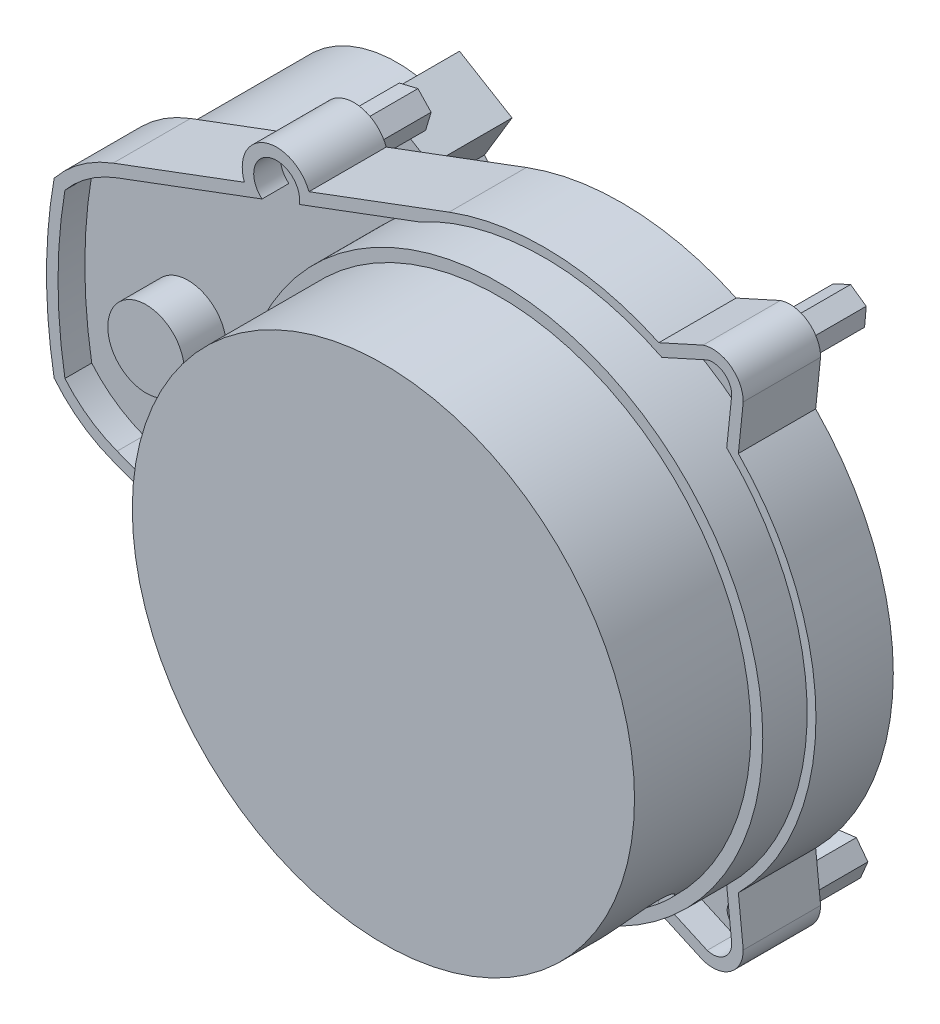
from build123d import *

# Parameters (mm, degrees)
ESQUISSE1_R             = 1.6
BOSS_EXTRU_1_DEPTH      = 10.1
ESQUISSE2_R             = 32.8
BOSS_EXTRU_2_DEPTH      = 21
ENL_V_MAT_EXTRU_1_DEPTH = 3.5
ESQUISSE4_R             = 32.8
BOSS_EXTRU_3_DEPTH      = 3.5
ESQUISSE5_R             = 16
BOSS_EXTRU_4_DEPTH      = 20.7
ESQUISSE8_R             = 5
BOSS_EXTRU_7_DEPTH      = 5.5
SKETCH6_R               = 34.35
BOSS_EXTRUDE3_DEPTH     = 9.3
CUT_EXTRUDE1_REACH      = 83.139
CUT_EXTRUDE1_END_RADIUS = 32.8
SKETCH5_R               = 5.25
ESQUISSE6_R             = 1
BOSS_EXTRU_5_DEPTH      = 7.7
BOSS_EXTRUDE4_DEPTH     = 10.6


with BuildPart() as part:
    # Esquisse1 → Boss.-Extru.1 (new body)
    with BuildSketch(Plane.XY):
        with BuildLine():
            ThreePointArc((-56.3, -16.861494596), (-60.528670487, -14.599558136), (-64.01, -11.301322931))
            ThreePointArc((-64.01, -11.301322931), (-65, 0), (-64.01, 11.301322931))
            ThreePointArc((-64.01, 11.301322931), (-60.528670487, 14.599558136), (-56.3, 16.861494596))
            Line((-56.3, 16.861494596), (-39.156313776, 23.266930519))
            ThreePointArc((-39.156313776, 23.266930519), (-36.515940127, 29.057304168), (-30.725566478, 26.416930519))
            Line((-30.725566478, 26.416930519), (-12.425, 33.254614341))
            ThreePointArc((-12.425, 33.254614341), (1.381675102, 35.473102119), (14.973963383, 32.187426436))
            Line((14.973963383, 32.187426436), (20.756023105, 34.801647207))
            ThreePointArc((20.756023105, 34.801647207), (24.347774736, 34.238511045), (26, 31))
            Line((26, 31), (25.359978077, 24.841930519))
            ThreePointArc((25.359978077, 24.841930519), (35.5, 0), (25.359978077, -24.841930519))
            Line((25.359978077, -24.841930519), (26, -31))
            ThreePointArc((26, -31), (24.347774736, -34.238511045), (20.756023105, -34.801647207))
            Line((20.756023105, -34.801647207), (14.973963383, -32.187426436))
            ThreePointArc((14.973963383, -32.187426436), (1.381675102, -35.473102119), (-12.425, -33.254614341))
            Line((-12.425, -33.254614341), (-30.725566478, -26.416930519))
            ThreePointArc((-30.725566478, -26.416930519), (-36.515940127, -29.057304168), (-39.156313776, -23.266930519))
            Line((-39.156313776, -23.266930519), (-56.3, -16.861494596))
        make_face()
        with Locations((-35, -25)):
            Circle(ESQUISSE1_R, mode=Mode.SUBTRACT)
        with Locations((22, 31)):
            Circle(ESQUISSE1_R, mode=Mode.SUBTRACT)
        with Locations((-35, 25)):
            Circle(ESQUISSE1_R, mode=Mode.SUBTRACT)
        with Locations((22, -31)):
            Circle(ESQUISSE1_R, mode=Mode.SUBTRACT)
    extrude(amount=BOSS_EXTRU_1_DEPTH)

    # Esquisse2 → Boss.-Extru.2 (add)
    with BuildSketch(Plane.XY.offset(10.1)):
        with Locations(Location((0, 0, 0), (0, 0, 180))):
            Circle(ESQUISSE2_R)
    extrude(amount=BOSS_EXTRU_2_DEPTH)

    # Esquisse3 → Enlèv. mat.-Extru.1 (cut)
    with BuildSketch(Plane.XY.offset(10.1)):
        with BuildLine():
            Line((-55.775, -15.456370046), (-36.849687238, -22.527479296))
            ThreePointArc((-36.849687238, -22.527479296), (-35.990940127, -27.652179619), (-31.982193016, -24.346132644))
            Line((-31.982193016, -24.346132644), (-11.9, -31.849489792))
            ThreePointArc((-11.9, -31.849489792), (1.664031028, -33.959255009), (14.956816294, -30.533484019))
            Line((14.956816294, -30.533484019), (21.291141631, -33.397398551))
            ThreePointArc((21.291141631, -33.397398551), (23.468656713, -33.023128137), (24.499056843, -31.06866508))
            Line((24.499056843, -31.06866508), (23.79417774, -24.286562245))
            ThreePointArc((23.79417774, -24.286562245), (34, 0), (23.79417774, 24.286562245))
            Line((23.79417774, 24.286562245), (24.499056843, 31.06866508))
            ThreePointArc((24.499056843, 31.06866508), (23.468656713, 33.023128137), (21.291141631, 33.397398551))
            Line((21.291141631, 33.397398551), (14.956816294, 30.533484019))
            ThreePointArc((14.956816294, 30.533484019), (1.664031028, 33.959255009), (-11.9, 31.849489792))
            Line((-11.9, 31.849489792), (-31.982193016, 24.346132644))
            ThreePointArc((-31.982193016, 24.346132644), (-35.990940127, 27.652179619), (-36.849687238, 22.527479296))
            Line((-36.849687238, 22.527479296), (-55.775, 15.456370046))
            ThreePointArc((-55.775, 15.456370046), (-59.496201473, 13.493411636), (-62.6, 10.653168543))
            ThreePointArc((-62.6, 10.653168543), (-63.5, 0), (-62.6, -10.653168543))
            ThreePointArc((-62.6, -10.653168543), (-59.496201473, -13.493411636), (-55.775, -15.456370046))
        make_face()
    extrude(amount=-ENL_V_MAT_EXTRU_1_DEPTH, mode=Mode.SUBTRACT)


with BuildPart() as enl_v_mat_extru_1_piece_1:
    # of the separate pieces the step leaves, piece 1, a body of its own (enl_v_mat_extru_1_pieces)
    add(part.part.solids().sort_by_distance((-32.8, 0, 10.1))[0])



with BuildPart() as enl_v_mat_extru_1_piece_2:
    # of the separate pieces the step leaves, piece 2, a body of its own (enl_v_mat_extru_1_pieces)
    add(part.part.solids().sort_by_distance((-64.01, 11.301322931, 0))[0])


with BuildPart() as enl_v_mat_extru_1_piece_1_1:
    add(enl_v_mat_extru_1_piece_1.part)

    add(enl_v_mat_extru_1_piece_2.part)  # Boss.-Extru.3 merges Enlèv. mat.-Extru.1 piece 2
    # Esquisse4 → Boss.-Extru.3 (add)
    with BuildSketch(Plane(origin=(0, 0, 10.1), x_dir=(-1, 0, 0), z_dir=(0, 0, -1))):
        with Locations(Location((0, 0, 0), (0, 0, 180))):
            Circle(ESQUISSE4_R)
    extrude(amount=BOSS_EXTRU_3_DEPTH)

    # Esquisse5 → Boss.-Extru.4 (add)
    with BuildSketch(Plane(origin=(0, 0, 0), x_dir=(-1, 0, 0), z_dir=(0, 0, -1))):
        with Locations(Location((50, 0, 0), (0, 0, 336.653490915))):
            Circle(ESQUISSE5_R)
    extrude(amount=BOSS_EXTRU_4_DEPTH)

    # Esquisse8 → Boss.-Extru.7 (add)
    with BuildSketch(Plane.XY.offset(6.6)):
        with Locations((-50, 0)):
            Circle(ESQUISSE8_R)
    extrude(amount=BOSS_EXTRU_7_DEPTH)

    # Sketch6 → Boss-Extrude3 (add)
    with BuildSketch(Plane.XY.offset(6.6)):
        with Locations(Location((0, 0, 0), (0, 0, 118.673428071))):
            Circle(SKETCH6_R)
    extrude(amount=BOSS_EXTRUDE3_DEPTH)

    # Cut-Extrude1: up to this cylinder (the profile starts inside it)
    cut_extrude1_end = Plane(origin=(0, 0, 21.7), z_dir=(0, 0, 1)) * Cylinder(CUT_EXTRUDE1_END_RADIUS, 232.878, mode=Mode.PRIVATE)
    # Sketch5 → Cut-Extrude1 (cut, up to the surface)
    with BuildSketch(Plane(origin=(0, 0, 0), x_dir=(1, 0, 0), z_dir=(0, 1, 0)), mode=Mode.PRIVATE) as cut_extrude1_sk1:
        with Locations(Location((-18, -21.7, 0), (0, 0, 270))):
            Circle(SKETCH5_R)
    cut_extrude1_tool1 = extrude(cut_extrude1_sk1.sketch, amount=-CUT_EXTRUDE1_REACH, mode=Mode.PRIVATE) & cut_extrude1_end
    add(cut_extrude1_tool1.solids().sort_by_distance((-18, 0, 21.7))[0], mode=Mode.SUBTRACT)
    # Sketch5 → Cut-Extrude1 (cut, up to the surface)
    with BuildSketch(Plane(origin=(0, 0, 0), x_dir=(1, 0, 0), z_dir=(0, 1, 0)), mode=Mode.PRIVATE) as cut_extrude1_sk2:
        with BuildLine():
            Line((14.75, -16.45), (21.25, -16.45))
            ThreePointArc((21.25, -16.45), (26.5, -21.7), (21.25, -26.95))
            Line((21.25, -26.95), (14.75, -26.95))
            ThreePointArc((14.75, -26.95), (9.5, -21.7), (14.75, -16.45))
        make_face()
    cut_extrude1_tool2 = extrude(cut_extrude1_sk2.sketch, amount=-CUT_EXTRUDE1_REACH, mode=Mode.PRIVATE) & cut_extrude1_end
    add(cut_extrude1_tool2.solids().sort_by_distance((18, 0, 21.7))[0], mode=Mode.SUBTRACT)

    # Esquisse6 → Boss.-Extru.5 (add)
    # profile 1 of 4: a face of its own
    with BuildSketch(Plane(origin=(0, 0, 0), x_dir=(-1, 0, 0), z_dir=(0, 0, -1))):
        Polygon((-20.489225606, -29.008126327), (-22.969626005, -28.695694159), (-24.480400399, -30.687567832), (-23.510774394, -32.991873673), (-21.030373995, -33.304305841), (-19.519599601, -31.312432168), align=None)
        with Locations((-22, -31)):
            Circle(ESQUISSE6_R, mode=Mode.SUBTRACT)
    # profile 2 of 4: a face of its own
    with BuildSketch(Plane(origin=(0, 0, 0), x_dir=(-1, 0, 0), z_dir=(0, 0, -1))):
        Polygon((36.086835018, -22.748602735), (33.593650283, -22.933074633), (32.506815266, -25.184471898), (33.913164982, -27.251397265), (36.406349717, -27.066925367), (37.493184734, -24.815528102), align=None)
        with Locations((35, -25)):
            Circle(ESQUISSE6_R, mode=Mode.SUBTRACT)
    # profile 3 of 4: a face of its own
    with BuildSketch(Plane(origin=(0, 0, 0), x_dir=(-1, 0, 0), z_dir=(0, 0, -1))):
        Polygon((36.720274889, 26.814016072), (34.289153443, 27.396809791), (32.568878555, 25.582793719), (33.279725111, 23.185983928), (35.710846557, 22.603190209), (37.431121445, 24.417206281), align=None)
        with Locations((35, 25)):
            Circle(ESQUISSE6_R, mode=Mode.SUBTRACT)
    # profile 4 of 4: a face of its own
    with BuildSketch(Plane(origin=(0, 0, 0), x_dir=(-1, 0, 0), z_dir=(0, 0, -1))):
        Polygon((-19.952160425, 32.43399898), (-22.217959758, 33.490480585), (-24.265799333, 32.056481605), (-24.047839575, 29.56600102), (-21.782040242, 28.509519415), (-19.734200667, 29.943518395), align=None)
        with Locations((-22, 31)):
            Circle(ESQUISSE6_R, mode=Mode.SUBTRACT)
    extrude(amount=BOSS_EXTRU_5_DEPTH)

    # Sketch7 → Boss-Extrude4 (add)
    with BuildSketch(Plane(origin=(0, 0, -20.7), x_dir=(-1, 0, 0), z_dir=(0, 0, -1))):
        with BuildLine():
            Line((45.459437733, 15.342206305), (41.857967445, 21.344656785))
            Line((41.857967445, 21.344656785), (38.427995742, 19.286673763))
            Line((38.427995742, 19.286673763), (34.998024039, 17.228690741))
            Line((34.998024039, 17.228690741), (38.599494327, 11.226240261))
            ThreePointArc((38.599494327, 11.226240261), (41.768067913, 13.719886811), (45.459437733, 15.342206305))
        make_face()
    extrude(amount=-BOSS_EXTRUDE4_DEPTH)


solid = enl_v_mat_extru_1_piece_1_1.part
